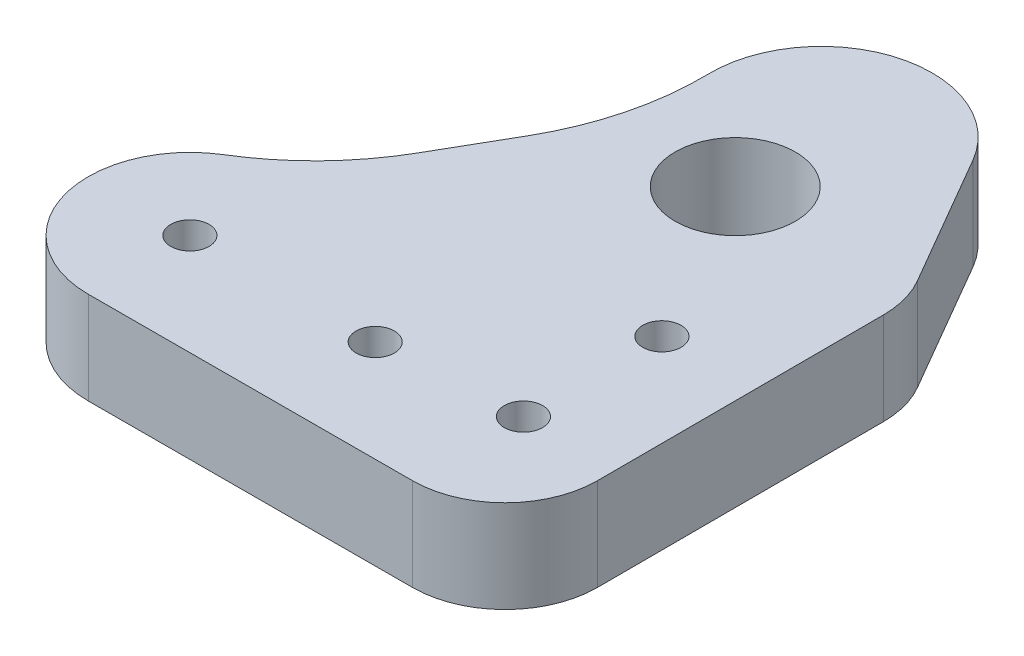
from build123d import *

# Parameters (mm, degrees)
SKETCH1_R           = 2.070000001
SKETCH1_R_2         = 2.07
SKETCH1_R_3         = 6.5
BOSS_EXTRUDE1_DEPTH = 10


with BuildPart() as part:
    # Sketch1 → Boss-Extrude1 (new body)
    with BuildSketch(Plane(origin=(0, 0, 0), x_dir=(1, 0, 0), z_dir=(0, 1, 0))):
        with BuildLine():
            Line((23.703500556, -15.152403716), (23.64205667, 15.828297469))
            ThreePointArc((23.64205667, 15.828297469), (23.296182467, 18.41580704), (22.292396885, 20.825630528))
            Line((22.292396885, 20.825630528), (13.99606221, 35.129712685))
            ThreePointArc((13.99606221, 35.129712685), (0.385615186, 40.666219429), (-8.382044752, 28.875319789))
            ThreePointArc((-8.382044752, 28.875319789), (-9.316904265, 20.837743246), (-12.365890121, 13.342392404))
            Line((-12.365890121, 13.342392404), (-16.723498541, 5.760104356))
            ThreePointArc((-16.723498541, 5.760104356), (-21.220226961, -0.19980824), (-27.049399397, -4.864770548))
            ThreePointArc((-27.049399397, -4.864770548), (-31.881873053, -17.239982686), (-21.276578026, -25.241632171))
            Line((-21.276578026, -25.241632171), (13.723353139, -25.172216965))
            ThreePointArc((13.723353139, -25.172216965), (20.788598117, -22.229266547), (23.703500556, -15.152403716))
        make_face()
        with Locations(Location((-21.298394234, -14.241653805, 0), (0, 0, 270))):
            Circle(SKETCH1_R, mode=Mode.SUBTRACT)
        with Locations(Location((-1.298433568, -14.201987971, 0), (0, 0, 270))):
            Circle(SKETCH1_R_2, mode=Mode.SUBTRACT)
        with Locations(Location((13.69955364, -13.172240563, 0), (0, 0, 270))):
            Circle(SKETCH1_R_2, mode=Mode.SUBTRACT)
        with Locations(Location((13.669804266, 1.827729936, 0), (0, 0, 270))):
            Circle(SKETCH1_R_2, mode=Mode.SUBTRACT)
        with Locations(Location((3.615677553, 19.807825031, 0), (0, 0, 270))):
            Circle(SKETCH1_R_3, mode=Mode.SUBTRACT)
    extrude(amount=BOSS_EXTRUDE1_DEPTH)


solid = part.part
